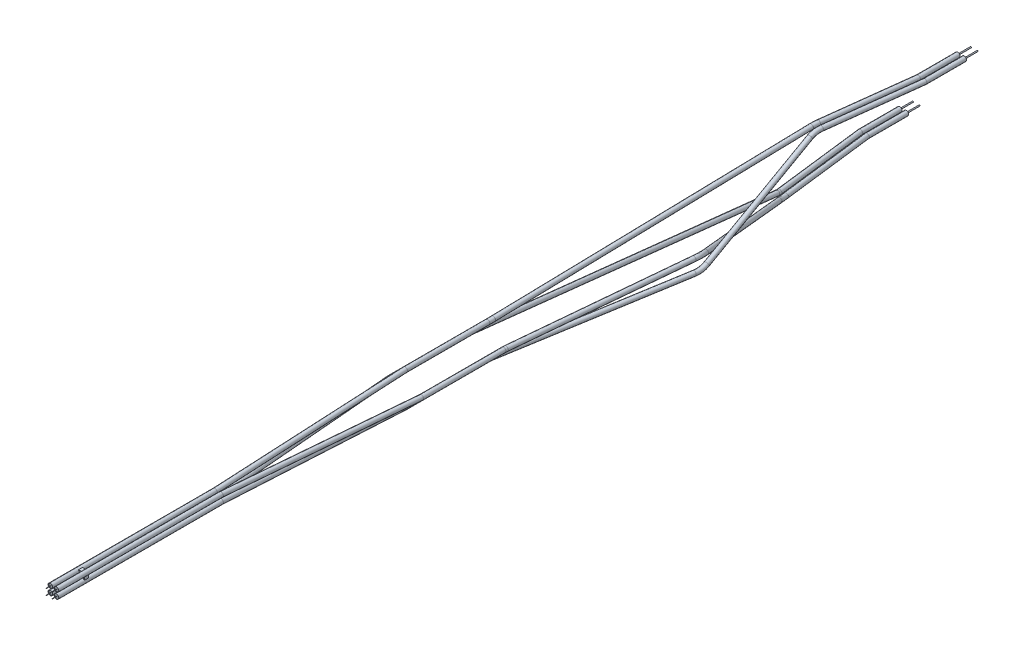
from build123d import *

# Parameters (mm, degrees)
SKETCH3_W         = 0.762
SKETCH3_H         = 0.254
SKETCH4_R         = 0.44831
SKETCH8_R         = 0.44831
SKETCH9_R         = 0.44831
SKETCH10_R        = 0.44831
SKETCH5_R         = 0.1016
PIN_LNA_END_DEPTH = 2.54
SKETCH15_R        = 0.3429
EXTRUDE1_DEPTH    = 0.0508
CIRPATTERN3_COUNT = 4
SKETCH12_R        = 0.03556
CIRPATTERN1_COUNT = 4


with BuildPart() as part:
    # Sketch3 → Revolve1 (revolve)
    with BuildSketch(Plane(origin=(0, 0, 0), x_dir=(0, 0, -1), z_dir=(1, 0, 0)), mode=Mode.PRIVATE) as revolve1_sk:
        with Locations((22.0726, 0.8128)):
            Rectangle(SKETCH3_W, SKETCH3_H)
    revolve(revolve1_sk.sketch.rotate(Axis((0, 0, -48.3616), (0, 0, 1)), 90), axis=Axis((0, 0, -48.3616), (0, 0, 1)))



with BuildPart() as body_2:
    # SW-00 Coax Jacket X Upper: sweep along a curve in space
    with BuildLine() as sw_00_coax_jacket_x_upper_path:
        Line((4.953, 7.3406, -186.055), (4.953, 7.3406, -178.435))
        Line((4.953, 7.3406, -178.435), (2.872478847, 7.3406, -161.301296391))
        ThreePointArc((2.763684005, 7.294574808, -160.006293151), (2.806048613, 7.329086153, -160.65439699), (2.872478847, 7.3406, -161.301296391))
        Line((2.763684005, 7.294574808, -160.006293151), (0.025075798, 3.13686962, -101.405085392))
        ThreePointArc((0.025075798, 3.13686962, -101.405085392), (0.006271765, 3.108321679, -100.868025718), (0, 3.0988, -100.33))
        Line((0, 3.0988, -100.33), (0, 3.0988, -84.455))
        Line((0, 3.0988, -84.455), (-0.5842, 0.5842, -48.3616))
        Line((-0.5842, 0.5842, -48.3616), (-0.5842, 0.5842, -16.6116))
    # Sketch4 → SW-00 Coax Jacket X Upper (sweep)
    with BuildSketch(Plane.XY.offset(-186.055)):
        with Locations((4.953, 7.3406)):
            Circle(SKETCH4_R)
    sweep(path=sw_00_coax_jacket_x_upper_path.line, transition=Transition.RIGHT)


with BuildPart() as part_1:
    add(part.part)

    add(body_2.part)  # SW-00 Coax Jacket X Lower merges body 2
    # SW-00 Coax Jacket X Lower: sweep along a curve in space
    with BuildLine() as sw_00_coax_jacket_x_lower_path:
        Line((6.223, 7.3406, -186.055), (6.223, 7.3406, -178.435))
        Line((6.223, 7.3406, -178.435), (4.064, 7.3406, -160.655))
        ThreePointArc((4.064, 7.3406, -160.655), (3.988053628, 7.232475572, -159.545590881), (4.031608054, 6.913332282, -158.475778791))
        Line((4.031608054, 6.913332282, -158.475778791), (6.240542312, -2.093682069, -136.351317112))
        ThreePointArc((6.240542312, -2.093682069, -136.351317112), (6.267702876, -2.431735493, -135.236611628), (6.134598563, -2.558955326, -134.08609675))
        Line((6.134598563, -2.558955326, -134.08609675), (0.084425486, -3.091370557, -101.254064355))
        ThreePointArc((0, -3.0988, -100.33), (0.021150572, -3.09693875, -100.793971387), (0.084425486, -3.091370557, -101.254064355))
        Line((0, -3.0988, -100.33), (0, -3.0988, -84.455))
        Line((0, -3.0988, -84.455), (0.5842, -0.5842, -48.3616))
        Line((0.5842, -0.5842, -48.3616), (0.5842, -0.5842, -16.6116))
    # Sketch8 → SW-00 Coax Jacket X Lower (sweep)
    with BuildSketch(Plane.XY.offset(-186.055)):
        with Locations((6.223, 7.3406)):
            Circle(SKETCH8_R)
    sweep(path=sw_00_coax_jacket_x_lower_path.line, transition=Transition.RIGHT)

    # Sweep3: sweep along a curve in space
    with BuildLine() as sweep3_path:
        Line((-6.223, -7.3406, -186.055), (-6.223, -7.3406, -178.435))
        Line((-6.223, -7.3406, -178.435), (-4.064, -7.3406, -160.655))
        ThreePointArc((-4.064, -7.3406, -160.655), (-4.044744837, -7.334400574, -160.452194223), (-4.036200061, -7.315842211, -160.249408743))
        Line((-4.036200061, -7.315842211, -160.249408743), (-3.0988, 0, -100.33))
        Line((-3.0988, 0, -100.33), (-3.0988, 0, -84.455))
        Line((-3.0988, 0, -84.455), (-0.5842, -0.5842, -48.3616))
        Line((-0.5842, -0.5842, -48.3616), (-0.5842, -0.5842, -16.6116))
    # Sketch9 → Sweep3 (sweep)
    with BuildSketch(Plane.XY.offset(-186.055)):
        with Locations((-6.223, -7.3406)):
            Circle(SKETCH9_R)
    sweep(path=sweep3_path.line, transition=Transition.RIGHT)

    # Sweep4: sweep along a curve in space
    with BuildLine() as sweep4_path:
        Line((-4.953, -7.3406, -186.055), (-4.953, -7.3406, -178.435))
        Line((-4.953, -7.3406, -178.435), (-2.794, -7.3406, -160.655))
        ThreePointArc((-2.794, -7.3406, -160.655), (-2.634137004, -7.277961709, -159.764314499), (-2.377457069, -7.092043967, -158.914402504))
        Line((-2.377457069, -7.092043967, -158.914402504), (5.900349004, -0.365392188, -136.473966054))
        ThreePointArc((5.900349004, -0.365392188, -136.473966054), (6.20364645, -0.092905525, -135.223267542), (6.224050743, 0, -133.911231978))
        Line((6.224050743, 0, -133.911231978), (3.12096799, 0, -100.804062615))
        ThreePointArc((3.12096799, 0, -100.804062615), (3.104345024, 0, -100.567290319), (3.0988, 0, -100.33))
        Line((3.0988, 0, -100.33), (3.0988, 0, -84.455))
        Line((3.0988, 0, -84.455), (0.5842, 0.5842, -48.3616))
        Line((0.5842, 0.5842, -48.3616), (0.5842, 0.5842, -16.6116))
    # Sketch10 → Sweep4 (sweep)
    with BuildSketch(Plane.XY.offset(-186.055)):
        with Locations((-4.953, -7.3406)):
            Circle(SKETCH10_R)
    sweep(path=sweep4_path.line, transition=Transition.RIGHT)

    # Sketch5 → Pin LNA End (add)
    with BuildSketch(Plane.XY.offset(-186.055)):
        with Locations((4.953, 7.3406)):
            Circle(SKETCH5_R)
        with Locations((6.223, 7.3406)):
            Circle(SKETCH5_R)
        with Locations((-4.953, -7.3406)):
            Circle(SKETCH5_R)
        with Locations((-6.223, -7.3406)):
            Circle(SKETCH5_R)
    extrude(amount=-PIN_LNA_END_DEPTH)

    # Sketch15 → Extrude1 (cut)
    with BuildSketch(Plane.XY.offset(-16.6116)):
        with Locations((-0.5842, 0.5842)):
            Circle(SKETCH15_R)
    extrude1 = extrude(amount=-EXTRUDE1_DEPTH, mode=Mode.SUBTRACT)

    # CirPattern3: Extrude1 ×4 about axis
    cirpattern3_axis = Axis((0, 0, 0), (0, 0, 1))
    for i in range(1, CIRPATTERN3_COUNT):
        add(extrude1.rotate(cirpattern3_axis, i * 360 / CIRPATTERN3_COUNT), mode=Mode.SUBTRACT)

    # Sweep5: sweep along a path in Sketch11
    with BuildLine(Plane(origin=(0, 0, 0), x_dir=(0, 0, -1), z_dir=(0.7071067811865459, 0.7071067811865491, 0))) as sweep5_path:
        Line((15.7988, 0.826183563), (16.6116, 0.826183563))
        Line((16.6116, 0.826183563), (17.229183431, 0.826183563))
    # Sketch12 → Sweep5 (sweep)
    with BuildSketch(Plane.XY.offset(-16.6624)):
        with Locations((-0.5842, 0.5842)):
            Circle(SKETCH12_R)
    sweep5 = sweep(path=sweep5_path.line)

    # CirPattern1: Sweep5 ×4 about axis
    cirpattern1_axis = Axis((0, 0, 4.39213043), (0, 0, -1))
    for i in range(1, CIRPATTERN1_COUNT):
        add(sweep5.rotate(cirpattern1_axis, i * 360 / CIRPATTERN1_COUNT))


solid = part_1.part
